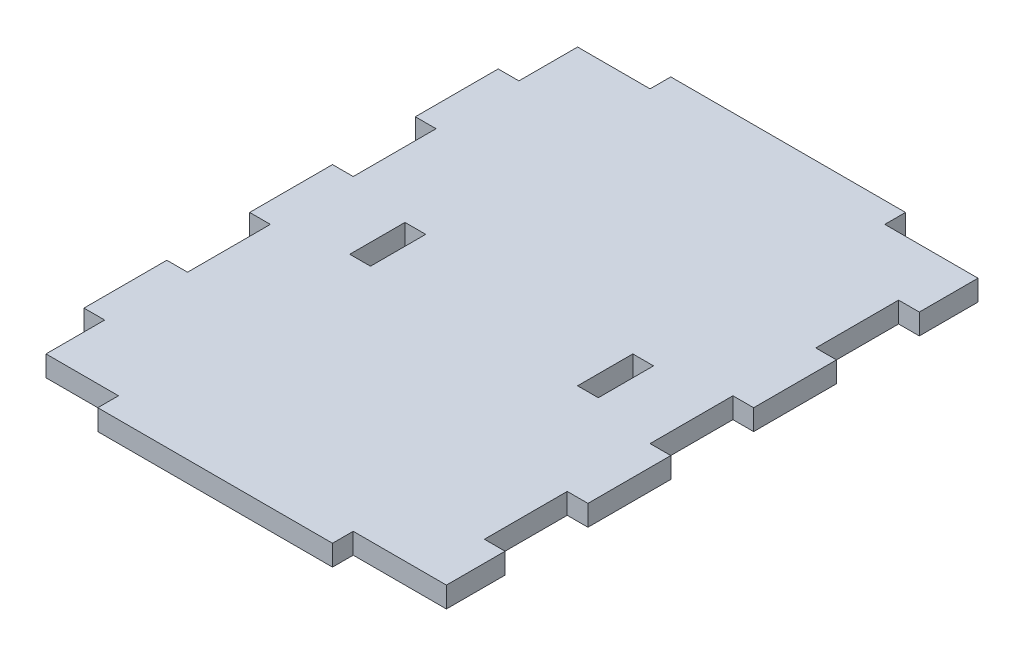
from build123d import *

# Parameters (mm, degrees)
SALIENTE_EXTRUIR1_DEPTH = 3
CORTAR_EXTRUIR1_DEPTH   = 10


with BuildPart() as part:
    # Croquis1 → Saliente-Extruir1 (new body)
    with BuildSketch(Plane(origin=(0, 0, 0), x_dir=(1, 0, 0), z_dir=(0, 1, 0))):
        Polygon((3, 35.5), (0, 35.5), (0, 47.5), (3, 47.5), (3, 59.5), (0, 59.5), (0, 71.5), (3, 71.5), (3, 80), (13.5, 80), (13.5, 83), (47.5, 83), (47.5, 80), (61, 80), (61, 71.5), (58, 71.5), (58, 59.5), (61, 59.5), (61, 47.5), (58, 47.5), (58, 35.5), (61, 35.5), (61, 23.5), (58, 23.5), (58, 11.5), (61, 11.5), (61, 3), (47.5, 3), (47.5, 0), (13.5, 0), (13.5, 3), (3, 3), (3, 11.5), (0, 11.5), (0, 23.5), (3, 23.5), align=None)
    extrude(amount=SALIENTE_EXTRUIR1_DEPTH)

    # Croquis2 → Cortar-Extruir1 (cut)
    with BuildSketch(Plane(origin=(0, 3, 0), x_dir=(1, 0, 0), z_dir=(0, 1, 0))):
        Polygon((15.5, 41.5), (15.5, 45.5), (12.5, 45.5), (12.5, 37.5), (15.5, 37.5), align=None)
        Polygon((45.5, 37.5), (45.5, 41.5), (45.5, 45.5), (48.5, 45.5), (48.5, 37.5), align=None)
    extrude(amount=-CORTAR_EXTRUIR1_DEPTH, mode=Mode.SUBTRACT)


solid = part.part
